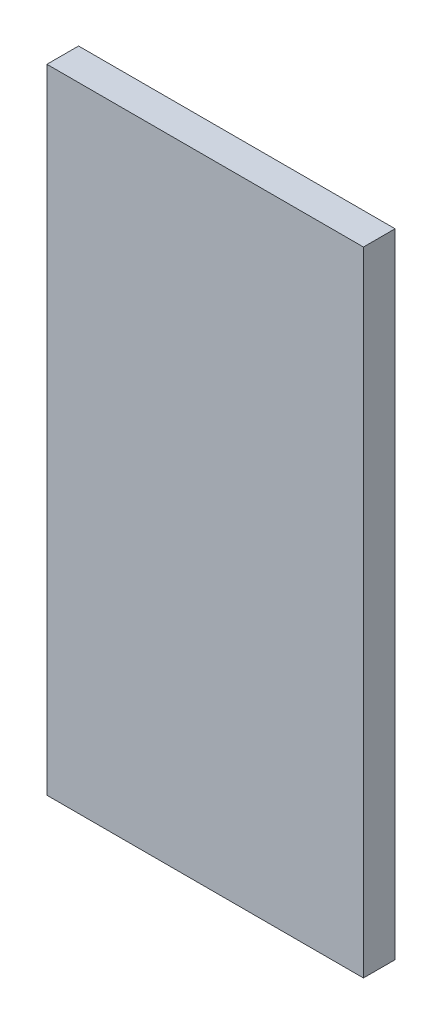
from build123d import *

# Parameters (mm, degrees)
SKETCH1_W           = 1000
SKETCH1_H           = 2000
BOSS_EXTRUDE1_DEPTH = 100


with BuildPart() as part:
    # Sketch1 → Boss-Extrude1 (new body)
    with BuildSketch(Plane.XY):
        Rectangle(SKETCH1_W, SKETCH1_H)
    extrude(amount=BOSS_EXTRUDE1_DEPTH)


solid = part.part
